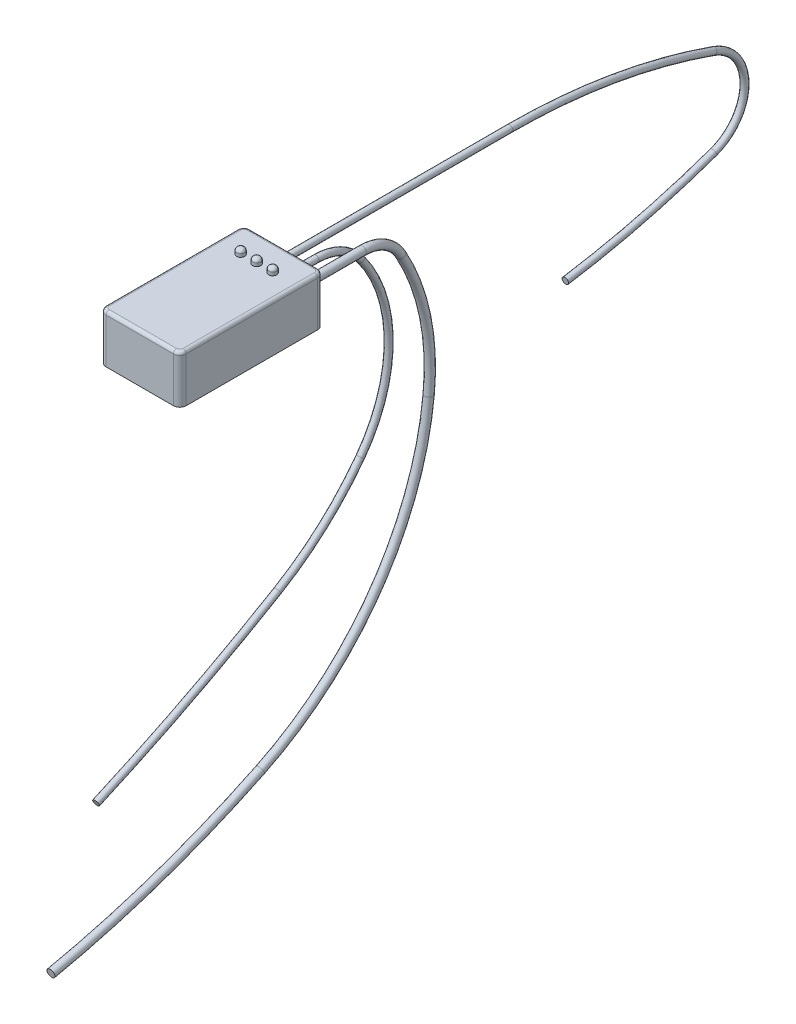
from build123d import *

# Parameters (mm, degrees)
CROQUIS1_W          = 50
CROQUIS1_H          = 90
EXTRUIR1_DEPTH      = 30
REDONDEO1_R         = 4
REDONDEO2_R         = 2
CROQUIS2_R          = 2.5
EXTRUIR2_DEPTH      = 2
EXTRUIR2_2_DEPTH    = 2
EXTRUIR2_3_DEPTH    = 2
C_PULA1_FACE_RADIUS = 2.5
C_PULA1_HEIGHT      = 2
C_PULA2_FACE_RADIUS = 2.5
C_PULA2_HEIGHT      = 2
C_PULA3_FACE_RADIUS = 2.5
C_PULA3_HEIGHT      = 2
CROQUIS4_R          = 2
CROQUIS6_R          = 2
CROQUIS8_R          = 2.5


with BuildPart() as part:
    # Croquis1 → Extruir1 (new body)
    with BuildSketch(Plane(origin=(0, 0, 0), x_dir=(1, 0, 0), z_dir=(0, 1, 0))):
        Rectangle(CROQUIS1_W, CROQUIS1_H)
    extrude(amount=EXTRUIR1_DEPTH)

    # Redondeo1
    redondeo1_edges = [part.edges().sort_by_distance(p)[0] for p in [
        (25, 15, 45),
        (25, 15, -45),
        (-25, 15, 45),
        (-25, 15, -45),
    ]]
    fillet(redondeo1_edges, radius=REDONDEO1_R)

    # Redondeo2
    redondeo2_edges = [part.edges().sort_by_distance(p)[0] for p in [
        (-23.828427125, 30, -43.828427125),
        (0, 30, -45),
        (23.828427125, 30, -43.828427125),
        (25, 30, 0),
        (23.828427125, 30, 43.828427125),
        (0, 30, 45),
        (-23.828427125, 30, 43.828427125),
        (-25, 30, 0),
    ]]
    fillet(redondeo2_edges, radius=REDONDEO2_R)


with BuildPart() as body_2:
    # Croquis2 → Extruir2 (new body)
    with BuildSketch(Plane(origin=(0, 30, 0), x_dir=(1, 0, 0), z_dir=(0, 1, 0))):
        with Locations((0, 28)):
            Circle(CROQUIS2_R)
    extrude(amount=EXTRUIR2_DEPTH)

    # Cúpula2: an elliptical dome of height H over a round flat face of radius A is half a spheroid: the quarter ellipse of half axes A and H revolved about the face's axis
    with BuildSketch(Plane((0, 32, -28), x_dir=(0, 0, -1), z_dir=(1, 0, 0)), mode=Mode.PRIVATE) as c_pula2_quarter:
        Ellipse(C_PULA2_FACE_RADIUS, C_PULA2_HEIGHT)
        Rectangle(C_PULA2_FACE_RADIUS, C_PULA2_HEIGHT, align=(Align.MIN, Align.MIN), mode=Mode.INTERSECT)
    revolve(c_pula2_quarter.sketch, axis=Axis((0, 32, -28), (0, 1, 0)))


with BuildPart() as body_3:
    # Croquis2 → Extruir2 2 (new body)
    with BuildSketch(Plane(origin=(0, 30, 0), x_dir=(1, 0, 0), z_dir=(0, 1, 0))):
        with Locations((10, 28)):
            Circle(CROQUIS2_R)
    extrude(amount=EXTRUIR2_2_DEPTH)

    # Cúpula3: an elliptical dome of height H over a round flat face of radius A is half a spheroid: the quarter ellipse of half axes A and H revolved about the face's axis
    with BuildSketch(Plane((10, 32, -28), x_dir=(0, 0, -1), z_dir=(1, 0, 0)), mode=Mode.PRIVATE) as c_pula3_quarter:
        Ellipse(C_PULA3_FACE_RADIUS, C_PULA3_HEIGHT)
        Rectangle(C_PULA3_FACE_RADIUS, C_PULA3_HEIGHT, align=(Align.MIN, Align.MIN), mode=Mode.INTERSECT)
    revolve(c_pula3_quarter.sketch, axis=Axis((10, 32, -28), (0, 1, 0)))


with BuildPart() as body_4:
    # Croquis2 → Extruir2 3 (new body)
    with BuildSketch(Plane(origin=(0, 30, 0), x_dir=(1, 0, 0), z_dir=(0, 1, 0))):
        with Locations((-10, 28)):
            Circle(CROQUIS2_R)
    extrude(amount=EXTRUIR2_3_DEPTH)

    # Cúpula1: an elliptical dome of height H over a round flat face of radius A is half a spheroid: the quarter ellipse of half axes A and H revolved about the face's axis
    with BuildSketch(Plane((-10, 32, -28), x_dir=(0, 0, -1), z_dir=(1, 0, 0)), mode=Mode.PRIVATE) as c_pula1_quarter:
        Ellipse(C_PULA1_FACE_RADIUS, C_PULA1_HEIGHT)
        Rectangle(C_PULA1_FACE_RADIUS, C_PULA1_HEIGHT, align=(Align.MIN, Align.MIN), mode=Mode.INTERSECT)
    revolve(c_pula1_quarter.sketch, axis=Axis((-10, 32, -28), (0, 1, 0)))


with BuildPart() as body_5:
    # Barrer1: sweep along a path in Croquis3
    with BuildLine(Plane.ZY.offset(10)) as barrer1_path:
        Line((-41, 14), (-195.95750906, 14))
        ThreePointArc((-195.95750906, 14), (-260.554402508, 8.508480699), (-323.297311871, -7.808466074))
        ThreePointArc((-323.297311871, -7.808466074), (-342.645931096, -35.154021923), (-323.297311871, -62.499577772))
        ThreePointArc((-323.297311871, -62.499577772), (-277.566637098, -76.29805142), (-230.758133528, -85.819421267))
    # Croquis4 → Barrer1 (sweep)
    with BuildSketch(Plane(origin=(-10, 14, -41), x_dir=(-1, 0, 0), z_dir=(0, 0, -1))):
        Circle(CROQUIS4_R)
    sweep(path=barrer1_path.line)


with BuildPart() as body_6:
    # Barrer2: sweep along a path in Croquis5
    with BuildLine(Plane.ZY) as barrer2_path:
        Line((-41, 14), (-64.960502846, 14))
        ThreePointArc((-64.960502846, 14), (-80.532809237, 10.302697731), (-92.781122993, 0))
        ThreePointArc((-92.781122993, 0), (-110.445020576, -53.450217376), (-92.781122993, -106.900434752))
        ThreePointArc((-92.781122993, -106.900434752), (-69.218884546, -132.820088242), (-41, -153.573451167))
        ThreePointArc((-41, -153.573451167), (14.750952816, -184.338773867), (72.269660943, -211.656753955))
    # Croquis6 → Barrer2 (sweep)
    with BuildSketch(Plane(origin=(-10, 14, -41), x_dir=(-1, 0, 0), z_dir=(0, 0, -1))):
        with Locations((-10, 0)):
            Circle(CROQUIS6_R)
    sweep(path=barrer2_path.line)


with BuildPart() as body_7:
    # Barrer3: sweep along a path in Croquis7
    with BuildLine(Plane.ZY.offset(-10)) as barrer3_path:
        Line((-41, 14), (-83.974417466, 14))
        ThreePointArc((-83.974417466, 14), (-97.815677613, 10.241992682), (-107.855831365, 0))
        ThreePointArc((-107.855831365, 0), (-123.141394108, -40.903578695), (-125.420776539, -84.510408369))
        ThreePointArc((-125.420776539, -84.510408369), (-92.436460413, -173.437061543), (-20.273692429, -234.987444743))
        ThreePointArc((-20.273692429, -234.987444743), (43.710194273, -261.337695914), (110.419046786, -279.727978421))
    # Croquis8 → Barrer3 (sweep)
    with BuildSketch(Plane(origin=(-10, 14, -41), x_dir=(-1, 0, 0), z_dir=(0, 0, -1))):
        with Locations((-20, 0)):
            Circle(CROQUIS8_R)
    sweep(path=barrer3_path.line)


solid = Compound([part.part, body_2.part, body_3.part, body_4.part, body_5.part, body_6.part, body_7.part])
